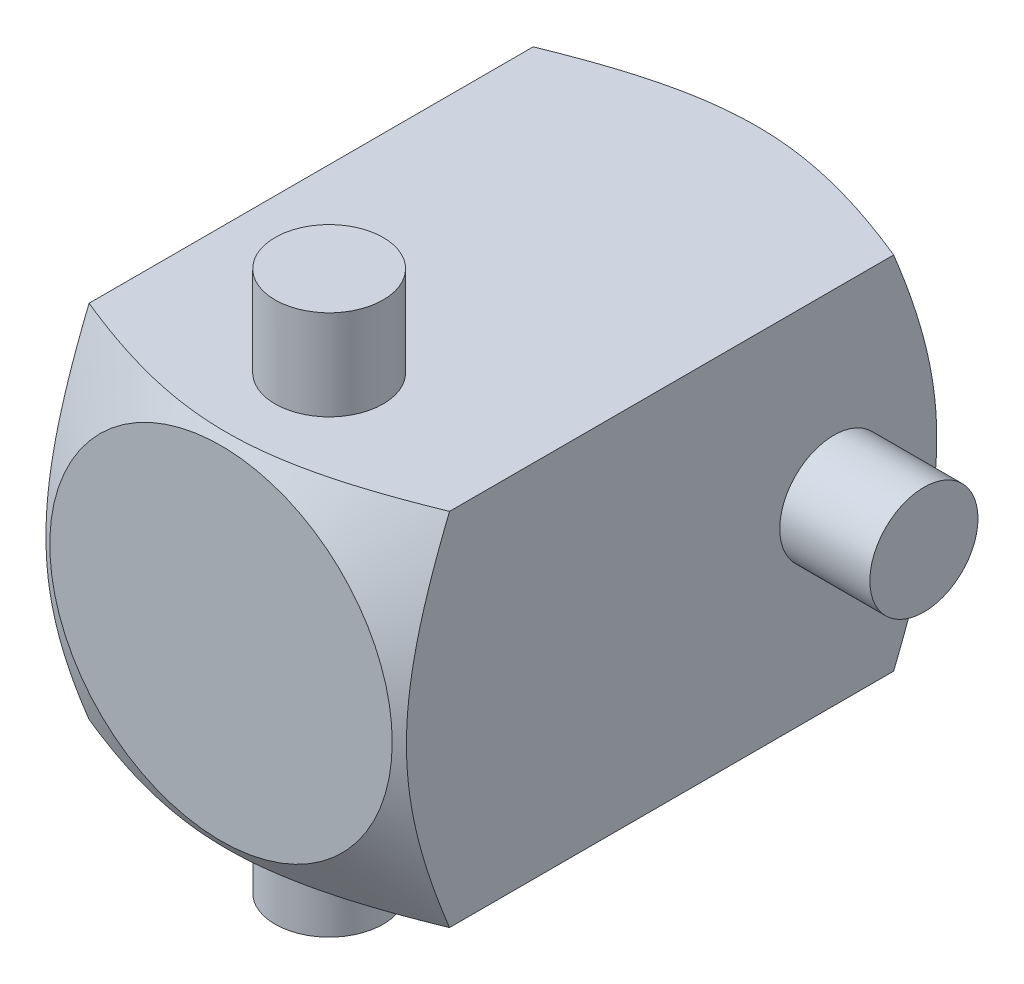
from build123d import *

# Parameters (mm, degrees)
SKETCH1_W           = 10
SKETCH1_H           = 10
BOSS_EXTRUDE1_DEPTH = 15
SKETCH3_R           = 1.5
BOSS_EXTRUDE2_DEPTH = 7.5
SKETCH4_R           = 1.5
BOSS_EXTRUDE3_DEPTH = 7.5


with BuildPart() as part:
    # Sketch1 → Boss-Extrude1 (new body)
    with BuildSketch(Plane.XY):
        Rectangle(SKETCH1_W, SKETCH1_H)
    extrude(amount=BOSS_EXTRUDE1_DEPTH)

    # Sketch2 → Cut-Revolve1 (revolve, cut)
    with BuildSketch(Plane(origin=(0, 0, 0), x_dir=(1, 0, 0), z_dir=(0, 1, 0)), mode=Mode.PRIVATE) as cut_revolve1_sk:
        Polygon((-4.75, 0), (-15.04, 0), (-15.04, -15), (-4.75, -15), (-12.5, -10.525535414), (-12.5, -4.474464586), align=None)
    revolve(cut_revolve1_sk.sketch.rotate(Axis((0, 0, 15.75), (0, 0, -1)), 44.999991596), axis=Axis((0, 0, 15.75), (0, 0, -1)), mode=Mode.SUBTRACT)

    # Sketch3 → Boss-Extrude2 (add, symmetric)
    with BuildSketch(Plane(origin=(0, 0, 0), x_dir=(1, 0, 0), z_dir=(0, 1, 0))):
        with Locations((0, -12)):
            Circle(SKETCH3_R)
    extrude(amount=BOSS_EXTRUDE2_DEPTH, both=True)

    # Sketch4 → Boss-Extrude3 (add, symmetric)
    with BuildSketch(Plane(origin=(0, 0, 0), x_dir=(0, 0, -1), z_dir=(1, 0, 0))):
        with Locations(Location((-3, 0, 0), (0, 0, 270))):
            Circle(SKETCH4_R)
    extrude(amount=BOSS_EXTRUDE3_DEPTH, both=True)


solid = part.part
